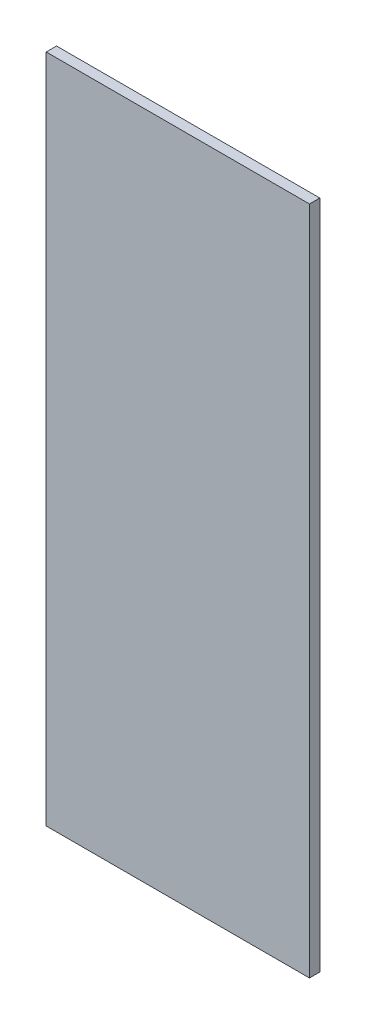
from build123d import *

# Parameters (mm, degrees)
SKETCH1_W           = 648
SKETCH1_H           = 1650
BOSS_EXTRUDE1_DEPTH = 25.4


with BuildPart() as part:
    # Sketch1 → Boss-Extrude1 (new body)
    with BuildSketch(Plane.XY):
        Rectangle(SKETCH1_W, SKETCH1_H)
    extrude(amount=BOSS_EXTRUDE1_DEPTH)


solid = part.part
